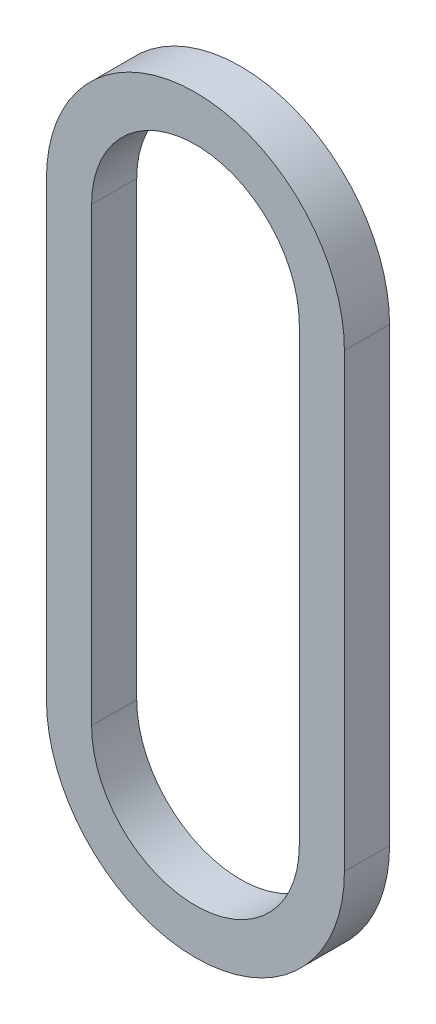
from build123d import *

# Parameters (mm, degrees)
EXTRUDE_1_DEPTH = 10


with BuildPart() as part:
    # 草图1 → 凸台-拉伸1 (new body)
    with BuildSketch(Plane.XY):
        with BuildLine():
            Line((-33, -50), (-33, 50))
            ThreePointArc((-33, 50), (0, 83), (33, 50))
            Line((33, 50), (33, -50))
            ThreePointArc((33, -50), (0, -83), (-33, -50))
        make_face()
        with BuildLine():
            Line((-23, -50), (-23, 50))
            ThreePointArc((-23, 50), (0, 73), (23, 50))
            Line((23, 50), (23, -50))
            ThreePointArc((23, -50), (0, -73), (-23, -50))
        make_face(mode=Mode.SUBTRACT)
    extrude(amount=EXTRUDE_1_DEPTH)


solid = part.part
